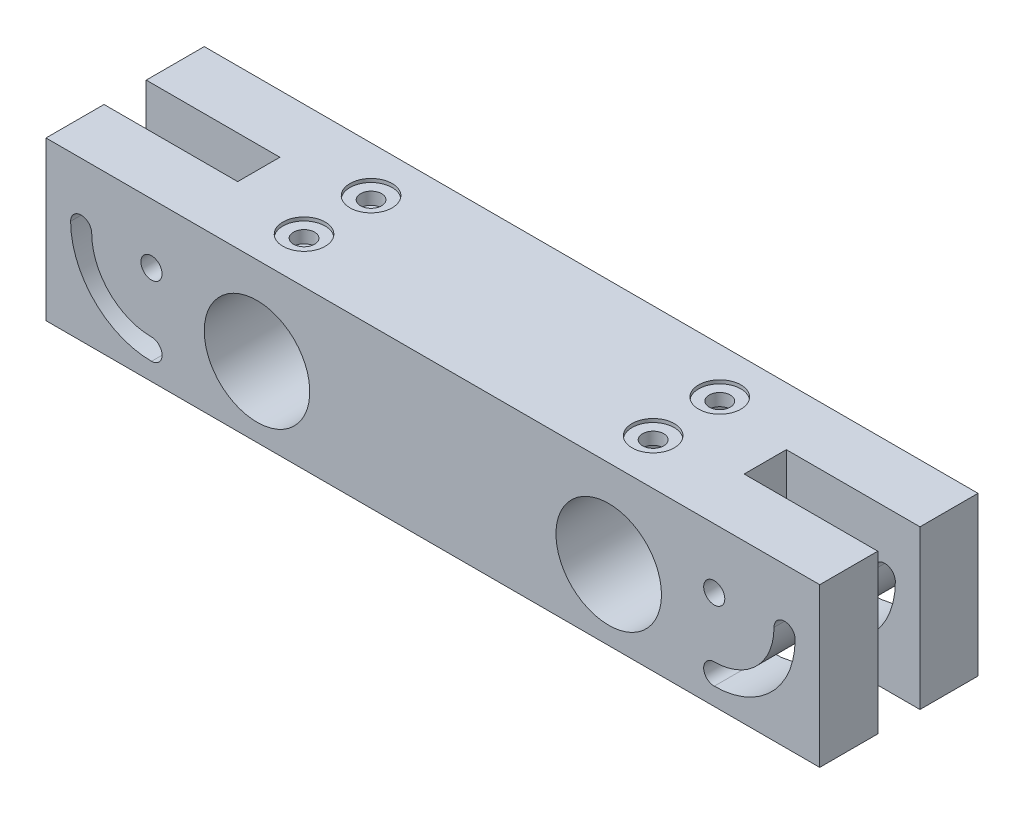
from build123d import *

# Parameters (mm, degrees)
SKETCH1_W               = 110
SKETCH1_H               = 45
SKETCH1_R               = 15
SKETCH1_R_2             = 3
BOSS_EXTRUDE1_DEPTH     = 45
CUT_EXTRUDE4_REACH      = 129.083
CUT_EXTRUDE4_END_RADIUS = 15
BOSS_EXTRUDE2_DEPTH     = 4.5
BOSS_EXTRUDE3_DEPTH     = 4.5
SKETCH12_R              = 3
CUT_EXTRUDE5_DEPTH      = 4.5
SKETCH15_R              = 3
CUT_EXTRUDE6_DEPTH      = 4.5
SKETCH16_R              = 6
CUT_EXTRUDE7_DEPTH      = 1
SKETCH18_W              = 38
SKETCH18_H              = 12
CUT_EXTRUDE8_DEPTH      = 128.082650271


with BuildPart() as part:
    # Sketch1 → Boss-Extrude1 (new body)
    with BuildSketch(Plane.XY):
        with Locations((55, 22.5)):
            Rectangle(SKETCH1_W, SKETCH1_H)
        with Locations(Location((50, 20, 0), (0, 0, 180))):
            Circle(SKETCH1_R, mode=Mode.SUBTRACT)
        with Locations(Location((80, 28, 0), (0, 0, 180))):
            Circle(SKETCH1_R_2, mode=Mode.SUBTRACT)
        with BuildLine():
            ThreePointArc((80, 5), (96.263455967, 11.736544033), (103, 28))
            ThreePointArc((103, 28), (100, 31), (97, 28))
            ThreePointArc((97, 28), (92.02081528, 15.97918472), (80, 11))
            ThreePointArc((80, 11), (77, 8), (80, 5))
        make_face(mode=Mode.SUBTRACT)
    boss_extrude1 = extrude(amount=BOSS_EXTRUDE1_DEPTH)

    # Cut-Extrude4: up to this cylinder (the profile starts outside it)
    cut_extrude4_end = Plane(origin=(50, 20, 22.5), z_dir=(0, 0, -1)) * Cylinder(CUT_EXTRUDE4_END_RADIUS, 308.166, mode=Mode.PRIVATE)
    # Sketch3 → Cut-Extrude4 (cut, up to the surface)
    with BuildSketch(Plane(origin=(0, 45, 0), x_dir=(1, 0, 0), z_dir=(0, 1, 0)), mode=Mode.PRIVATE) as cut_extrude4_sk1:
        Polygon((55.485397506, -32), (52.59864616, -27), (46.825143468, -27), (43.938392122, -32), (46.825143468, -37), (52.59864616, -37), align=None)
    cut_extrude4_tool1 = extrude(cut_extrude4_sk1.sketch, amount=-CUT_EXTRUDE4_REACH, mode=Mode.PRIVATE) - cut_extrude4_end
    add(cut_extrude4_tool1.solids().sort_by_distance((49.711895, 45, 32))[0], mode=Mode.SUBTRACT)
    # Sketch3 → Cut-Extrude4 (cut, up to the surface)
    with BuildSketch(Plane(origin=(0, 45, 0), x_dir=(1, 0, 0), z_dir=(0, 1, 0)), mode=Mode.PRIVATE) as cut_extrude4_sk2:
        Polygon((55.485397506, -13), (52.59864616, -8), (46.825143468, -8), (43.938392122, -13), (46.825143468, -18), (52.59864616, -18), align=None)
    cut_extrude4_tool2 = extrude(cut_extrude4_sk2.sketch, amount=-CUT_EXTRUDE4_REACH, mode=Mode.PRIVATE) - cut_extrude4_end
    add(cut_extrude4_tool2.solids().sort_by_distance((49.711895, 45, 13))[0], mode=Mode.SUBTRACT)

    # Sketch9 → Boss-Extrude2 (add)
    with BuildSketch(Plane(origin=(0, 45, 0), x_dir=(1, 0, 0), z_dir=(0, 1, 0))):
        Polygon((46.825143468, -8), (43.938392122, -13), (46.825143468, -18), (52.59864616, -18), (55.485397506, -13), (52.59864616, -8), align=None)
    extrude(amount=-BOSS_EXTRUDE2_DEPTH)

    # Sketch10 → Boss-Extrude3 (add)
    with BuildSketch(Plane(origin=(0, 45, 0), x_dir=(1, 0, 0), z_dir=(0, 1, 0))):
        Polygon((43.938392122, -32), (46.825143468, -37), (52.59864616, -37), (55.485397506, -32), (52.59864616, -27), (46.825143468, -27), align=None)
    extrude(amount=-BOSS_EXTRUDE3_DEPTH)

    # Sketch12 → Cut-Extrude5 (cut)
    with BuildSketch(Plane.XZ.offset(-40.5)):
        with Locations(Location((49.576462362, 13, 0), (0, 0, 270))):
            Circle(SKETCH12_R)
    cut_extrude5 = extrude(amount=-CUT_EXTRUDE5_DEPTH, mode=Mode.SUBTRACT)

    # Sketch15 → Cut-Extrude6 (cut)
    with BuildSketch(Plane.XZ.offset(-40.5)):
        with Locations(Location((49.63041025, 32, 0), (0, 0, 270))):
            Circle(SKETCH15_R)
    cut_extrude6 = extrude(amount=-CUT_EXTRUDE6_DEPTH, mode=Mode.SUBTRACT)

    # Sketch16 → Cut-Extrude7 (cut)
    with BuildSketch(Plane(origin=(0, 45, 0), x_dir=(1, 0, 0), z_dir=(0, 1, 0))):
        with Locations(Location((49.63041025, -32, 0), (0, 0, 270))):
            Circle(SKETCH16_R)
        with Locations(Location((49.576462362, -13, 0), (0, 0, 270))):
            Circle(SKETCH16_R)
    cut_extrude7 = extrude(amount=-CUT_EXTRUDE7_DEPTH, mode=Mode.SUBTRACT)

    # Sketch18 → Cut-Extrude8 (cut, through all)
    with BuildSketch(Plane(origin=(0, 45, 0), x_dir=(1, 0, 0), z_dir=(0, 1, 0))):
        with Locations((91, -22.5)):
            Rectangle(SKETCH18_W, SKETCH18_H)
    cut_extrude8 = extrude(amount=-CUT_EXTRUDE8_DEPTH, mode=Mode.SUBTRACT)

    # Mirror1: Boss-Extrude1, Cut-Extrude5, Cut-Extrude6, Cut-Extrude7, Cut-Extrude8 across plane
    add(boss_extrude1.mirror(Plane(origin=(0, 0, 45), x_dir=(0, 0, 1), z_dir=(-1, 0, 0))))
    add(cut_extrude5.mirror(Plane(origin=(0, 0, 45), x_dir=(0, 0, 1), z_dir=(-1, 0, 0))), mode=Mode.SUBTRACT)
    add(cut_extrude6.mirror(Plane(origin=(0, 0, 45), x_dir=(0, 0, 1), z_dir=(-1, 0, 0))), mode=Mode.SUBTRACT)
    add(cut_extrude7.mirror(Plane(origin=(0, 0, 45), x_dir=(0, 0, 1), z_dir=(-1, 0, 0))), mode=Mode.SUBTRACT)
    add(cut_extrude8.mirror(Plane(origin=(0, 0, 45), x_dir=(0, 0, 1), z_dir=(-1, 0, 0))), mode=Mode.SUBTRACT)


solid = part.part
